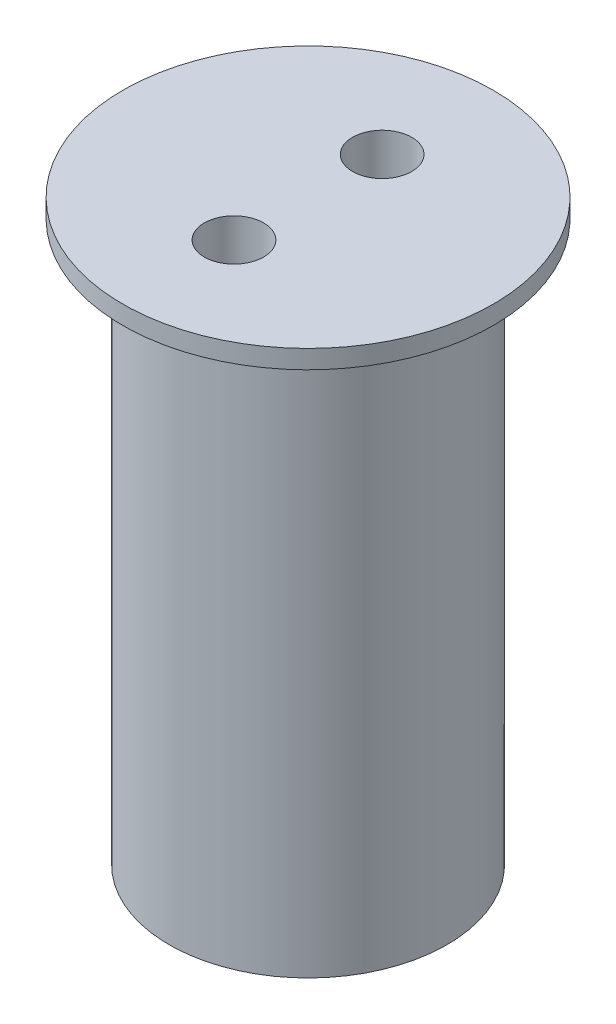
from build123d import *

# Parameters (mm, degrees)
SKETCH_2_R          = 1.6
CUT_EXTRUDE_1_DEPTH = 42


with BuildPart() as part:
    # 草图1 → 旋转1 (revolve)
    with BuildSketch(Plane.XY, mode=Mode.PRIVATE) as revolve_1_sk:
        Polygon((0, 14.96953125), (10, 14.96953125), (10, 13.96953125), (7.5, 13.96953125), (7.5, -16.23046875), (0, -16.23046875), align=None)
    revolve(revolve_1_sk.sketch.rotate(Axis((0, -16.23046875, 0), (0, 1, 0)), 90), axis=Axis((0, -16.23046875, 0), (0, 1, 0)))

    # 草图2 → 切除-拉伸1 (cut)
    with BuildSketch(Plane.XZ.offset(16.23046875)):
        with Locations(Location((0, 4, 0), (0, 0, 270))):
            Circle(SKETCH_2_R)
        with Locations(Location((0, -4, 0), (0, 0, 270))):
            Circle(SKETCH_2_R)
    extrude(amount=-CUT_EXTRUDE_1_DEPTH, mode=Mode.SUBTRACT)


solid = part.part
